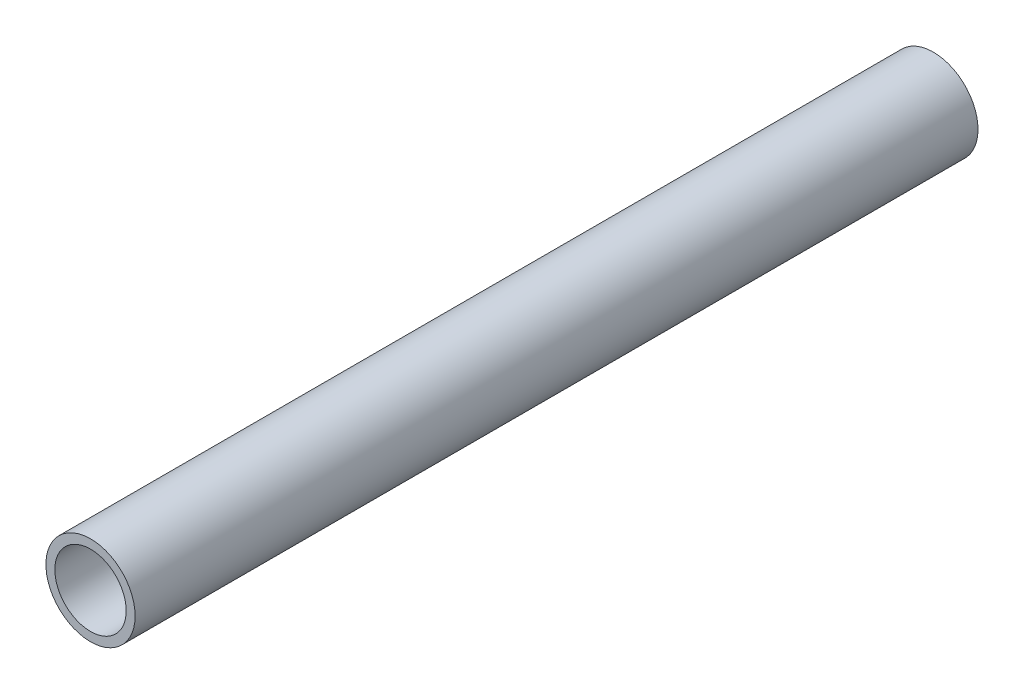
from build123d import *

# Parameters (mm, degrees)
ESQUISSE1_R        = 10
ESQUISSE1_R_2      = 8
EXTRU_MINCE1_DEPTH = 189


with BuildPart() as part:
    # Esquisse1 → Extru.-Mince1 (new body)
    with BuildSketch(Plane.XY):
        Circle(ESQUISSE1_R)
        Circle(ESQUISSE1_R_2, mode=Mode.SUBTRACT)
    extrude(amount=EXTRU_MINCE1_DEPTH)


solid = part.part
